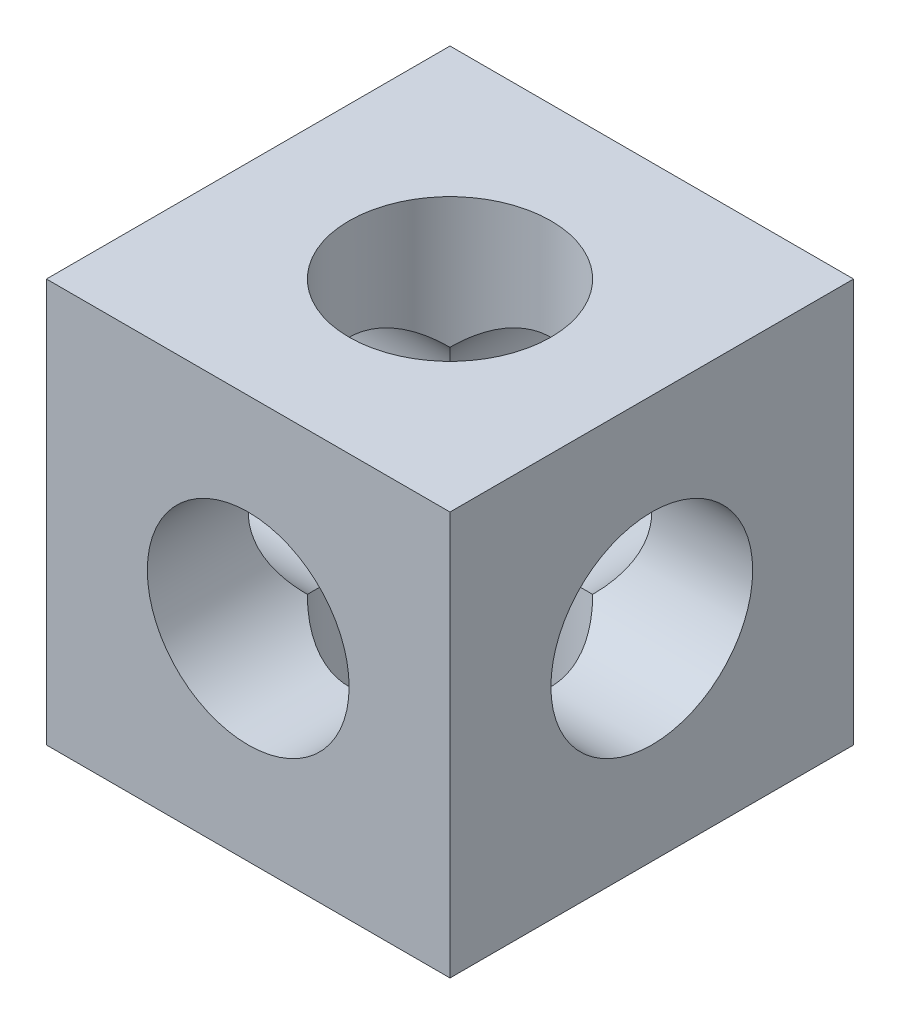
from build123d import *

# Parameters (mm, degrees)
SKETCH_1_W          = 6
SKETCH_1_H          = 6
EXTRUDE_1_DEPTH     = 6
SKETCH_2_R          = 1.5
CUT_EXTRUDE_1_DEPTH = 8.348469228
SKETCH_3_R          = 1.5
CUT_EXTRUDE_2_DEPTH = 10
SKETCH_4_R          = 1.5
CUT_EXTRUDE_3_DEPTH = 10


with BuildPart() as part:
    # 草图1 → 凸台-拉伸1 (new body)
    with BuildSketch(Plane.XY):
        Rectangle(SKETCH_1_W, SKETCH_1_H)
    extrude(amount=EXTRUDE_1_DEPTH)

    # 草图2 → 切除-拉伸1 (cut, through all)
    with BuildSketch(Plane.XY.offset(6)):
        Circle(SKETCH_2_R)
    extrude(amount=-CUT_EXTRUDE_1_DEPTH, mode=Mode.SUBTRACT)

    # 草图3 → 切除-拉伸2 (cut, through all)
    with BuildSketch(Plane(origin=(3, 0, 0), x_dir=(0, 0, -1), z_dir=(1, 0, 0))):
        with Locations((-3, 0)):
            Circle(SKETCH_3_R)
    extrude(amount=-CUT_EXTRUDE_2_DEPTH, mode=Mode.SUBTRACT)

    # 草图4 → 切除-拉伸3 (cut, through all)
    with BuildSketch(Plane(origin=(0, 3, 0), x_dir=(1, 0, 0), z_dir=(0, 1, 0))):
        with Locations(Location((0, -3, 0), (0, 0, 270))):
            Circle(SKETCH_4_R)
    extrude(amount=-CUT_EXTRUDE_3_DEPTH, mode=Mode.SUBTRACT)


solid = part.part
